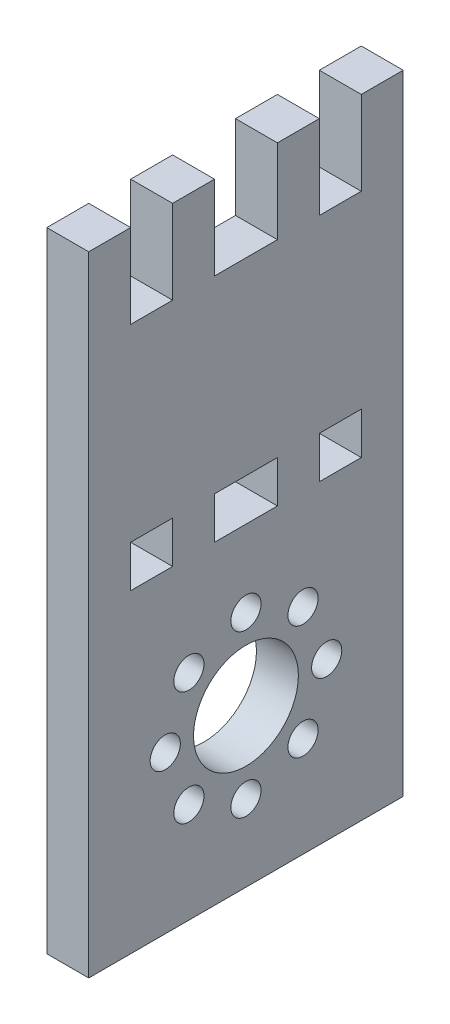
from build123d import *

# Parameters (mm, degrees)
SKETCH1_W           = 38.1
SKETCH1_H           = 76.2
SKETCH1_R           = 1.8288
SKETCH1_R_2         = 6.35
BOSS_EXTRUDE1_DEPTH = 5.08
SKETCH2_W           = 5.08
SKETCH2_H           = 10.16
SKETCH2_W_2         = 7.62
SKETCH2_H_2         = 5.08
CUT_EXTRUDE1_DEPTH  = 5.08


with BuildPart() as part:
    # Sketch1 → Boss-Extrude1 (new body)
    with BuildSketch(Plane(origin=(0, 0, 0), x_dir=(0, 0, -1), z_dir=(1, 0, 0))):
        with Locations((-19.05, -9.087068966)):
            Rectangle(SKETCH1_W, SKETCH1_H)
        with Locations((-19.05, -18.358068966)):
            Circle(SKETCH1_R, mode=Mode.SUBTRACT)
        with Locations((-19.05, -28.137068966)):
            Circle(SKETCH1_R_2, mode=Mode.SUBTRACT)
        with Locations((-12.135202787, -21.222271752)):
            Circle(SKETCH1_R, mode=Mode.SUBTRACT)
        with Locations((-9.271, -28.137068966)):
            Circle(SKETCH1_R, mode=Mode.SUBTRACT)
        with Locations((-12.135202787, -35.051866179)):
            Circle(SKETCH1_R, mode=Mode.SUBTRACT)
        with Locations((-19.05, -37.916068966)):
            Circle(SKETCH1_R, mode=Mode.SUBTRACT)
        with Locations((-25.964797213, -35.051866179)):
            Circle(SKETCH1_R, mode=Mode.SUBTRACT)
        with Locations((-28.829, -28.137068966)):
            Circle(SKETCH1_R, mode=Mode.SUBTRACT)
        with Locations((-25.964797213, -21.222271752)):
            Circle(SKETCH1_R, mode=Mode.SUBTRACT)
    extrude(amount=BOSS_EXTRUDE1_DEPTH)

    # Sketch2 → Cut-Extrude1 (cut)
    with BuildSketch(Plane(origin=(5.08, 0, 0), x_dir=(0, 0, -1), z_dir=(1, 0, 0))):
        with Locations((-30.48, 23.932931034)):
            Rectangle(SKETCH2_W, SKETCH2_H)
        with Locations((-7.62, 23.932931034)):
            Rectangle(SKETCH2_W, SKETCH2_H)
        with Locations((-19.05, 23.932931034)):
            Rectangle(SKETCH2_W_2, SKETCH2_H)
        with Locations((-30.48, -6.547068966)):
            Rectangle(SKETCH2_W, SKETCH2_H_2)
        with Locations((-19.05, -6.547068966)):
            Rectangle(SKETCH2_W_2, SKETCH2_H_2)
        with Locations((-7.62, -6.547068966)):
            Rectangle(SKETCH2_W, SKETCH2_H_2)
    extrude(amount=-CUT_EXTRUDE1_DEPTH, mode=Mode.SUBTRACT)


solid = part.part
